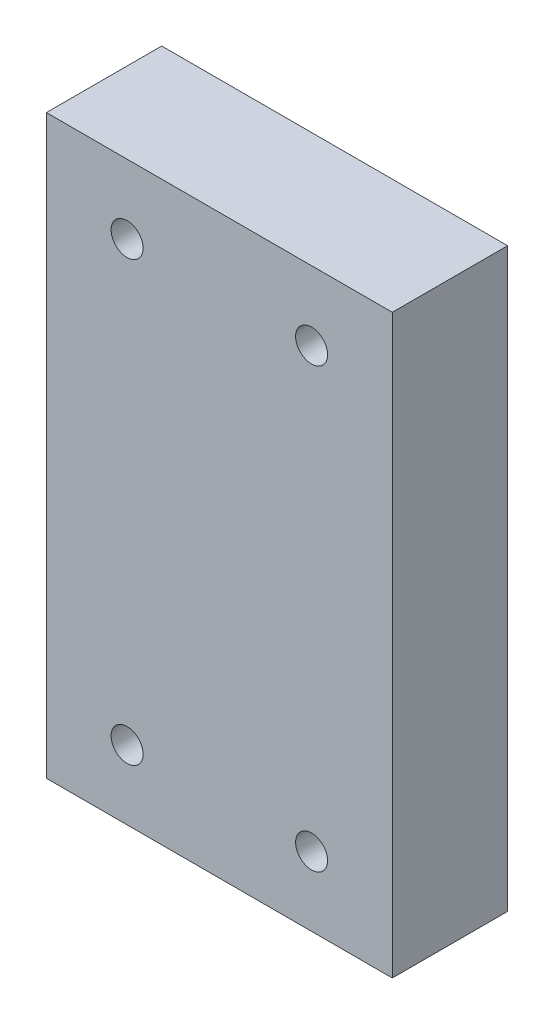
from build123d import *

# Parameters (mm, degrees)
SKETCH1_W           = 30
SKETCH1_H           = 50
SKETCH1_R           = 1.387394958
BOSS_EXTRUDE1_DEPTH = 10
SKETCH3_R           = 2
CUT_EXTRUDE1_DEPTH  = 10


with BuildPart() as part:
    # Sketch1 → Boss-Extrude1 (new body)
    with BuildSketch(Plane.XY):
        Rectangle(SKETCH1_W, SKETCH1_H)
        with Locations((-8, 19)):
            Circle(SKETCH1_R, mode=Mode.SUBTRACT)
        with Locations(Location((8, 19, 0), (0, 0, 180))):
            Circle(SKETCH1_R, mode=Mode.SUBTRACT)
        with Locations((8, -19)):
            Circle(SKETCH1_R, mode=Mode.SUBTRACT)
        with Locations(Location((-8, -19, 0), (0, 0, 180))):
            Circle(SKETCH1_R, mode=Mode.SUBTRACT)
    extrude(amount=BOSS_EXTRUDE1_DEPTH)

    # Sketch3 → Cut-Extrude1 (cut)
    with BuildSketch(Plane.ZY.offset(15)):
        with Locations(Location((5, 12.5, 0), (0, 0, 270))):
            Circle(SKETCH3_R)
        with Locations(Location((5, -12.5, 0), (0, 0, 90))):
            Circle(SKETCH3_R)
    extrude(amount=-CUT_EXTRUDE1_DEPTH, mode=Mode.SUBTRACT)


solid = part.part
